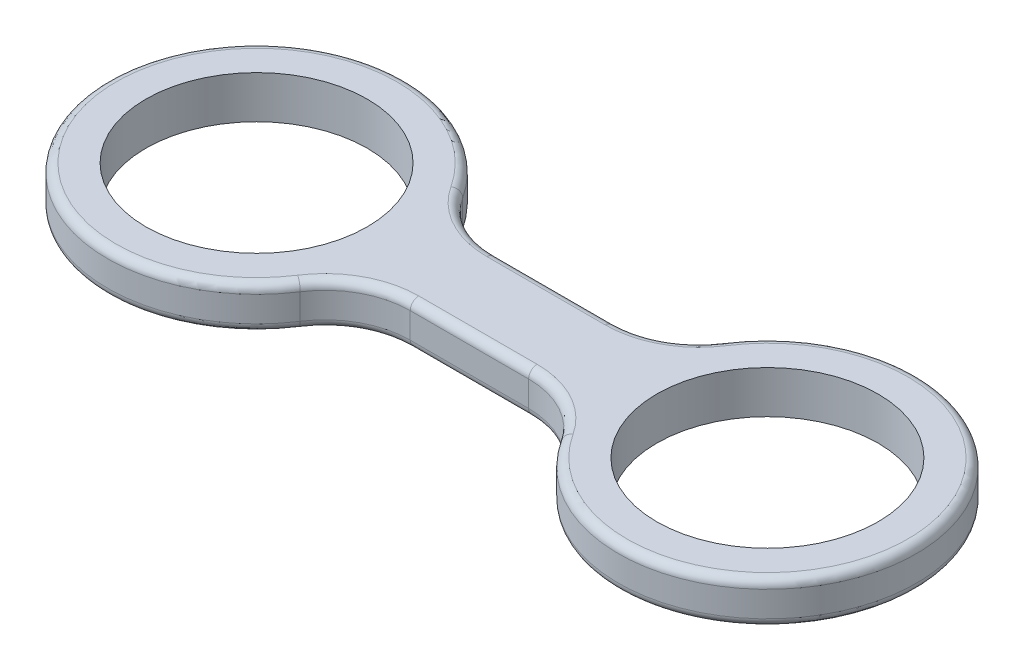
from build123d import *

# Parameters (mm, degrees)
SKETCH1_R           = 13
BOSS_EXTRUDE1_DEPTH = 5
FILLET1_R           = 10
FILLET2_R           = 1


with BuildPart() as part:
    # Sketch1 → Boss-Extrude1 (new body)
    with BuildSketch(Plane(origin=(0, 0, 0), x_dir=(1, 0, 0), z_dir=(0, 1, 0))):
        with BuildLine():
            Line((16.770509831, 5), (43.229490169, 5))
            ThreePointArc((43.229490169, 5), (77.5, 0), (43.229490169, -5))
            Line((43.229490169, -5), (16.770509831, -5))
            ThreePointArc((16.770509831, -5), (-17.5, 0), (16.770509831, 5))
        make_face()
        with Locations(Location((0, 0, 0), (0, 0, 270))):
            Circle(SKETCH1_R, mode=Mode.SUBTRACT)
        with Locations(Location((60, 0, 0), (0, 0, 270))):
            Circle(SKETCH1_R, mode=Mode.SUBTRACT)
    extrude(amount=BOSS_EXTRUDE1_DEPTH)

    # Fillet1
    fillet1_edges = [part.edges().sort_by_distance(p)[0] for p in [
        (16.770509831, 2.5, -5),
        (43.229490169, 2.5, -5),
        (43.229490169, 2.5, 5),
        (16.770509831, 2.5, 5),
    ]]
    fillet(fillet1_edges, radius=FILLET1_R)

    # Fillet2
    fillet2_edges = [part.edges().sort_by_distance(p)[0] for p in [
        (77.5, 0, 0),
        (77.5, 5, 0),
        (30, 0, 5),
        (30, 5, 5),
        (-17.5, 0, 0),
        (-17.5, 5, 0),
        (30, 0, -5),
        (30, 5, -5),
        (41.718451803, 0, 6.20950927),
        (41.718451803, 5, 6.20950927),
        (18.281548197, 0, 6.20950927),
        (18.281548197, 5, 6.20950927),
        (41.718451803, 0, -6.20950927),
        (41.718451803, 5, -6.20950927),
        (18.281548197, 0, -6.20950927),
        (18.281548197, 5, -6.20950927),
    ]]
    fillet(fillet2_edges, radius=FILLET2_R)


solid = part.part
